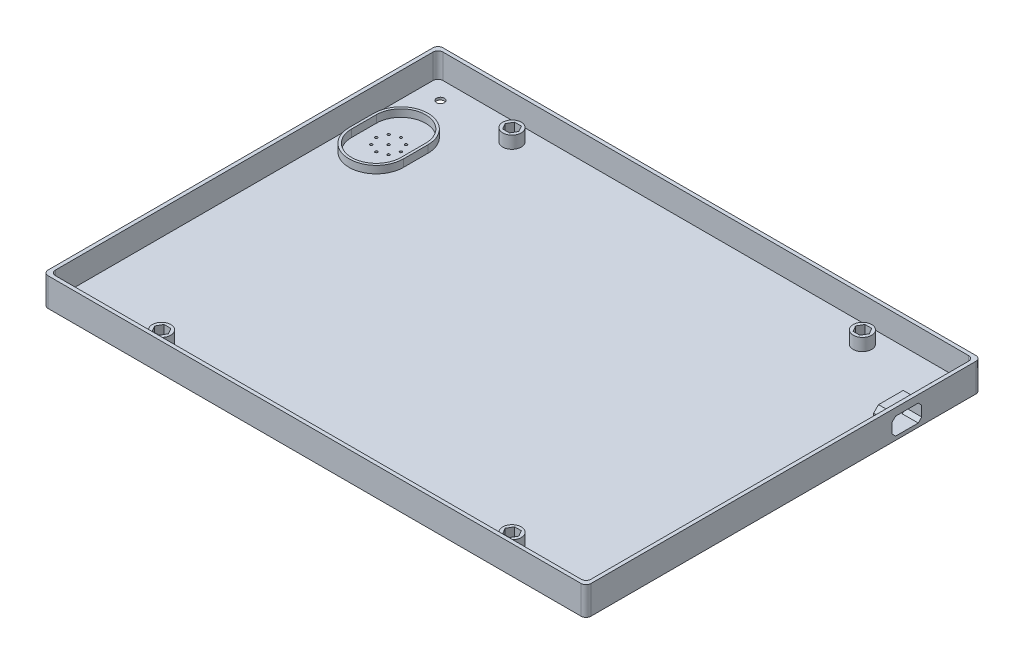
from build123d import *

# Parameters (mm, degrees)
EXTRUDE_1_DEPTH                 = 1
EXTRUDE_1_DEPTH_BACK            = 0.5
SKETCH_1_W                      = 220
SKETCH_1_H                      = 160
SKETCH_2_R                      = 3.75
EXTRUDE_2_DEPTH                 = 5
CUT_EXTRUDE_5_REACH             = 138.17
SKETCH_3_R                      = 1.6
CUT_EXTRUDE_5_DIRECTION_2_DEPTH = 137.169930601
CUT_EXTRUDE_START               = -0.5
SKETCH_4_R                      = 3
CUT_EXTRUDE_7_DEPTH             = 0.5
SKETCH_5_W                      = 220
SKETCH_5_H                      = 160
SKETCH_5_W_2                    = 217
SKETCH_5_H_2                    = 157
EXTRUDE_3_DEPTH                 = 10
FILLET_1_R                      = 2
FILLET_2_R                      = 2
FILLET_3_R                      = 2
CUT_EXTRUDE_8_REACH             = 236.352
CUT_EXTRUDE_8_DIRECTION_2_DEPTH = 235.352298901
EXTRUDE_4_DEPTH                 = 5
EXTRUDE_5_DEPTH                 = 3
CUT_EXTRUDE_9_REACH             = 138.382
SKETCH_10_R                     = 0.5


with BuildPart() as part:
    # 草图1 → 凸台-拉伸1 (new, two sides: drawn at the far end of the back side and taken through both)
    with BuildSketch(Plane(origin=(0, 0, 0), x_dir=(1, 0, 0), z_dir=(0, 1, 0)).offset(-EXTRUDE_1_DEPTH_BACK)):
        Rectangle(SKETCH_1_W, SKETCH_1_H)
    extrude(amount=EXTRUDE_1_DEPTH + EXTRUDE_1_DEPTH_BACK)

    # 草图2 → 凸台-拉伸2 (add)
    # profile 1 of 4: a face of its own
    with BuildSketch(Plane(origin=(0, 1, 0), x_dir=(1, 0, 0), z_dir=(0, 1, 0))):
        with Locations(Location((-71, 71, 0), (0, 0, 270))):
            Circle(SKETCH_2_R)
        Polygon((-69.614359354, 68.6), (-68.228718708, 71), (-69.614359354, 73.4), (-72.385640646, 73.4), (-73.771281292, 71), (-72.385640646, 68.6), align=None, mode=Mode.SUBTRACT)
    # profile 2 of 4: a face of its own
    with BuildSketch(Plane(origin=(0, 1, 0), x_dir=(1, 0, 0), z_dir=(0, 1, 0))):
        with Locations(Location((71, 71, 0), (0, 0, 90))):
            Circle(SKETCH_2_R)
        Polygon((72.385640646, 68.6), (69.614359354, 68.6), (68.228718708, 71), (69.614359354, 73.4), (72.385640646, 73.4), (73.771281292, 71), align=None, mode=Mode.SUBTRACT)
    # profile 3 of 4: a face of its own
    with BuildSketch(Plane(origin=(0, 1, 0), x_dir=(1, 0, 0), z_dir=(0, 1, 0))):
        with Locations(Location((71, -71, 0), (0, 0, 270))):
            Circle(SKETCH_2_R)
        Polygon((69.614359354, -68.6), (68.228718708, -71), (69.614359354, -73.4), (72.385640646, -73.4), (73.771281292, -71), (72.385640646, -68.6), align=None, mode=Mode.SUBTRACT)
    # profile 4 of 4: a face of its own
    with BuildSketch(Plane(origin=(0, 1, 0), x_dir=(1, 0, 0), z_dir=(0, 1, 0))):
        with Locations(Location((-71, -71, 0), (0, 0, 90))):
            Circle(SKETCH_2_R)
        Polygon((-72.385640646, -68.6), (-69.614359354, -68.6), (-68.228718708, -71), (-69.614359354, -73.4), (-72.385640646, -73.4), (-73.771281292, -71), align=None, mode=Mode.SUBTRACT)
    extrude(amount=EXTRUDE_2_DEPTH)

    # 草图3 → 切除-拉伸5 (cut, up to next)
    with BuildSketch(Plane.XZ.offset(0.5), mode=Mode.PRIVATE) as cut_extrude_5_sk1:
        with Locations(Location((-100, -71, 0), (0, 0, 90))):
            Circle(SKETCH_3_R)
    cut_extrude_5_tool1 = extrude(cut_extrude_5_sk1.sketch, amount=-CUT_EXTRUDE_5_REACH, mode=Mode.PRIVATE) & part.part
    # 草图3 → 切除-拉伸5 (cut, up to next)
    with BuildSketch(Plane.XZ.offset(0.5), mode=Mode.PRIVATE) as cut_extrude_5_sk2:
        with Locations(Location((100, -71, 0), (0, 0, 90))):
            Circle(SKETCH_3_R)
    cut_extrude_5_tool2 = extrude(cut_extrude_5_sk2.sketch, amount=-CUT_EXTRUDE_5_REACH, mode=Mode.PRIVATE) & part.part
    # 草图3 → 切除-拉伸5 (cut, up to next)
    with BuildSketch(Plane.XZ.offset(0.5), mode=Mode.PRIVATE) as cut_extrude_5_sk3:
        with Locations(Location((100, 71, 0), (0, 0, 90))):
            Circle(SKETCH_3_R)
    cut_extrude_5_tool3 = extrude(cut_extrude_5_sk3.sketch, amount=-CUT_EXTRUDE_5_REACH, mode=Mode.PRIVATE) & part.part
    # 草图3 → 切除-拉伸5 (cut, up to next)
    with BuildSketch(Plane.XZ.offset(0.5), mode=Mode.PRIVATE) as cut_extrude_5_sk4:
        with Locations(Location((-100, 71, 0), (0, 0, 90))):
            Circle(SKETCH_3_R)
    cut_extrude_5_tool4 = extrude(cut_extrude_5_sk4.sketch, amount=-CUT_EXTRUDE_5_REACH, mode=Mode.PRIVATE) & part.part
    add(cut_extrude_5_tool1.solids().sort_by_distance((-100, -0.5, -71))[0], mode=Mode.SUBTRACT)
    add(cut_extrude_5_tool2.solids().sort_by_distance((100, -0.5, -71))[0], mode=Mode.SUBTRACT)
    add(cut_extrude_5_tool3.solids().sort_by_distance((100, -0.5, 71))[0], mode=Mode.SUBTRACT)
    add(cut_extrude_5_tool4.solids().sort_by_distance((-100, -0.5, 71))[0], mode=Mode.SUBTRACT)

    # 草图3 → 切除-拉伸5 direction 2 (cut)
    with BuildSketch(Plane.XZ.offset(0.5)):
        with Locations(Location((-100, -71, 0), (0, 0, 90))):
            Circle(SKETCH_3_R)
        with Locations(Location((100, -71, 0), (0, 0, 90))):
            Circle(SKETCH_3_R)
        with Locations(Location((100, 71, 0), (0, 0, 90))):
            Circle(SKETCH_3_R)
        with Locations(Location((-100, 71, 0), (0, 0, 90))):
            Circle(SKETCH_3_R)
    extrude(amount=CUT_EXTRUDE_5_DIRECTION_2_DEPTH, mode=Mode.SUBTRACT)

    # 草图4 → 切除-拉伸7 (cut)
    with BuildSketch(Plane(origin=(0, 0, 0), x_dir=(1, 0, 0), z_dir=(0, 1, 0)).offset(CUT_EXTRUDE_START)):
        with Locations(Location((-100, 71, 0), (0, 0, 270))):
            Circle(SKETCH_4_R)
        with Locations(Location((100, 71, 0), (0, 0, 90))):
            Circle(SKETCH_4_R)
        with Locations(Location((100, -71, 0), (0, 0, 270))):
            Circle(SKETCH_4_R)
        with Locations(Location((-100, -71, 0), (0, 0, 90))):
            Circle(SKETCH_4_R)
    extrude(amount=CUT_EXTRUDE_7_DEPTH, mode=Mode.SUBTRACT)

    # 草图5 → 凸台-拉伸3 (add)
    with BuildSketch(Plane(origin=(0, 1, 0), x_dir=(1, 0, 0), z_dir=(0, 1, 0))):
        Rectangle(SKETCH_5_W, SKETCH_5_H)
        Rectangle(SKETCH_5_W_2, SKETCH_5_H_2, mode=Mode.SUBTRACT)
    extrude(amount=EXTRUDE_3_DEPTH)

    # 圆角1
    fillet_1_edges = [part.edges().sort_by_distance(p)[0] for p in [
        (-110, 5.25, -80),
    ]]
    fillet(fillet_1_edges, radius=FILLET_1_R)

    # 圆角2
    fillet_2_edges = [part.edges().sort_by_distance(p)[0] for p in [
        (-108.5, 6, -78.5),
    ]]
    fillet(fillet_2_edges, radius=FILLET_2_R)

    # 圆角3
    fillet_3_edges = [part.edges().sort_by_distance(p)[0] for p in [
        (108.5, 6, 78.5),
        (108.5, 6, -78.5),
        (-108.5, 6, 78.5),
        (110, 5.25, 80),
        (-110, 5.25, 80),
        (110, 5.25, -80),
    ]]
    fillet(fillet_3_edges, radius=FILLET_3_R)

    # 草图7 → 切除-拉伸8 (cut, up to next)
    with BuildSketch(Plane(origin=(110, 0, 0), x_dir=(0, 0, -1), z_dir=(1, 0, 0)), mode=Mode.PRIVATE) as cut_extrude_8_sk1:
        Polygon((45.435952693, 8), (54.607525568, 8), (56.02173913, 6.585786438), (56.02173913, 2.414213562), (54.607525568, 1), (45.435952693, 1), (44.02173913, 2.414213562), (44.02173913, 6.585786438), align=None)
    cut_extrude_8_tool1 = extrude(cut_extrude_8_sk1.sketch, amount=-CUT_EXTRUDE_8_REACH, mode=Mode.PRIVATE) & part.part
    add(cut_extrude_8_tool1.solids().sort_by_distance((110, 4.5, -50.021739))[0], mode=Mode.SUBTRACT)

    # 草图7 → 切除-拉伸8 direction 2 (cut)
    with BuildSketch(Plane(origin=(110, 0, 0), x_dir=(0, 0, -1), z_dir=(1, 0, 0))):
        Polygon((45.435952693, 8), (54.607525568, 8), (56.02173913, 6.585786438), (56.02173913, 2.414213562), (54.607525568, 1), (45.435952693, 1), (44.02173913, 2.414213562), (44.02173913, 6.585786438), align=None)
    extrude(amount=CUT_EXTRUDE_8_DIRECTION_2_DEPTH, mode=Mode.SUBTRACT)

    # 草图8 → 凸台-拉伸4 (add)
    with BuildSketch(Plane.ZY.offset(-108.5)):
        Polygon((-44.435952693, 1), (-43.02173913, 2.414213562), (-43.02173913, 7), (-45.02173913, 9), (-55.02173913, 9), (-57.02173913, 7), (-57.02173913, 2.414213562), (-55.607525568, 1), (-54.607525568, 1), (-56.02173913, 2.414213562), (-56.02173913, 6.585786438), (-54.607525568, 8), (-45.435952693, 8), (-44.02173913, 6.585786438), (-44.02173913, 2.414213562), (-45.435952693, 1), align=None)
    extrude(amount=EXTRUDE_4_DEPTH)

    # 草图9 → 凸台-拉伸5 (add)
    with BuildSketch(Plane(origin=(0, 1, 0), x_dir=(1, 0, 0), z_dir=(0, 1, 0))):
        with BuildLine():
            Line((-84, 50), (-84, 40))
            ThreePointArc((-84, 40), (-95, 29), (-106, 40))
            Line((-106, 40), (-106, 50))
            ThreePointArc((-106, 50), (-95, 61), (-84, 50))
        make_face()
        with BuildLine():
            Line((-85, 50), (-85, 40))
            ThreePointArc((-85, 40), (-95, 30), (-105, 40))
            Line((-105, 40), (-105, 50))
            ThreePointArc((-105, 50), (-95, 60), (-85, 50))
        make_face(mode=Mode.SUBTRACT)
    extrude(amount=EXTRUDE_5_DEPTH)

    # 草图10 → 切除-拉伸9 (cut, up to next)
    with BuildSketch(Plane(origin=(0, 1, 0), x_dir=(1, 0, 0), z_dir=(0, 1, 0)), mode=Mode.PRIVATE) as cut_extrude_9_sk1:
        with Locations(Location((-95, 45, 0), (0, 0, 270))):
            Circle(SKETCH_10_R)
    cut_extrude_9_tool1 = extrude(cut_extrude_9_sk1.sketch, amount=-CUT_EXTRUDE_9_REACH, mode=Mode.PRIVATE) & part.part
    # 草图10 → 切除-拉伸9 (cut, up to next)
    with BuildSketch(Plane(origin=(0, 1, 0), x_dir=(1, 0, 0), z_dir=(0, 1, 0)), mode=Mode.PRIVATE) as cut_extrude_9_sk2:
        with Locations(Location((-100, 45, 0), (0, 0, 270))):
            Circle(SKETCH_10_R)
    cut_extrude_9_tool2 = extrude(cut_extrude_9_sk2.sketch, amount=-CUT_EXTRUDE_9_REACH, mode=Mode.PRIVATE) & part.part
    # 草图10 → 切除-拉伸9 (cut, up to next)
    with BuildSketch(Plane(origin=(0, 1, 0), x_dir=(1, 0, 0), z_dir=(0, 1, 0)), mode=Mode.PRIVATE) as cut_extrude_9_sk3:
        with Locations(Location((-98.535533906, 48.535533906, 0), (0, 0, 270))):
            Circle(SKETCH_10_R)
    cut_extrude_9_tool3 = extrude(cut_extrude_9_sk3.sketch, amount=-CUT_EXTRUDE_9_REACH, mode=Mode.PRIVATE) & part.part
    # 草图10 → 切除-拉伸9 (cut, up to next)
    with BuildSketch(Plane(origin=(0, 1, 0), x_dir=(1, 0, 0), z_dir=(0, 1, 0)), mode=Mode.PRIVATE) as cut_extrude_9_sk4:
        with Locations(Location((-95, 50, 0), (0, 0, 270))):
            Circle(SKETCH_10_R)
    cut_extrude_9_tool4 = extrude(cut_extrude_9_sk4.sketch, amount=-CUT_EXTRUDE_9_REACH, mode=Mode.PRIVATE) & part.part
    # 草图10 → 切除-拉伸9 (cut, up to next)
    with BuildSketch(Plane(origin=(0, 1, 0), x_dir=(1, 0, 0), z_dir=(0, 1, 0)), mode=Mode.PRIVATE) as cut_extrude_9_sk5:
        with Locations(Location((-91.464466094, 48.535533906, 0), (0, 0, 270))):
            Circle(SKETCH_10_R)
    cut_extrude_9_tool5 = extrude(cut_extrude_9_sk5.sketch, amount=-CUT_EXTRUDE_9_REACH, mode=Mode.PRIVATE) & part.part
    # 草图10 → 切除-拉伸9 (cut, up to next)
    with BuildSketch(Plane(origin=(0, 1, 0), x_dir=(1, 0, 0), z_dir=(0, 1, 0)), mode=Mode.PRIVATE) as cut_extrude_9_sk6:
        with Locations(Location((-90, 45, 0), (0, 0, 270))):
            Circle(SKETCH_10_R)
    cut_extrude_9_tool6 = extrude(cut_extrude_9_sk6.sketch, amount=-CUT_EXTRUDE_9_REACH, mode=Mode.PRIVATE) & part.part
    # 草图10 → 切除-拉伸9 (cut, up to next)
    with BuildSketch(Plane(origin=(0, 1, 0), x_dir=(1, 0, 0), z_dir=(0, 1, 0)), mode=Mode.PRIVATE) as cut_extrude_9_sk7:
        with Locations(Location((-91.464466094, 41.464466094, 0), (0, 0, 270))):
            Circle(SKETCH_10_R)
    cut_extrude_9_tool7 = extrude(cut_extrude_9_sk7.sketch, amount=-CUT_EXTRUDE_9_REACH, mode=Mode.PRIVATE) & part.part
    # 草图10 → 切除-拉伸9 (cut, up to next)
    with BuildSketch(Plane(origin=(0, 1, 0), x_dir=(1, 0, 0), z_dir=(0, 1, 0)), mode=Mode.PRIVATE) as cut_extrude_9_sk8:
        with Locations(Location((-95, 40, 0), (0, 0, 270))):
            Circle(SKETCH_10_R)
    cut_extrude_9_tool8 = extrude(cut_extrude_9_sk8.sketch, amount=-CUT_EXTRUDE_9_REACH, mode=Mode.PRIVATE) & part.part
    # 草图10 → 切除-拉伸9 (cut, up to next)
    with BuildSketch(Plane(origin=(0, 1, 0), x_dir=(1, 0, 0), z_dir=(0, 1, 0)), mode=Mode.PRIVATE) as cut_extrude_9_sk9:
        with Locations(Location((-98.535533906, 41.464466094, 0), (0, 0, 270))):
            Circle(SKETCH_10_R)
    cut_extrude_9_tool9 = extrude(cut_extrude_9_sk9.sketch, amount=-CUT_EXTRUDE_9_REACH, mode=Mode.PRIVATE) & part.part
    add(cut_extrude_9_tool1.solids().sort_by_distance((-95, 1, -45))[0], mode=Mode.SUBTRACT)
    add(cut_extrude_9_tool2.solids().sort_by_distance((-100, 1, -45))[0], mode=Mode.SUBTRACT)
    add(cut_extrude_9_tool3.solids().sort_by_distance((-98.535534, 1, -48.535534))[0], mode=Mode.SUBTRACT)
    add(cut_extrude_9_tool4.solids().sort_by_distance((-95, 1, -50))[0], mode=Mode.SUBTRACT)
    add(cut_extrude_9_tool5.solids().sort_by_distance((-91.464466, 1, -48.535534))[0], mode=Mode.SUBTRACT)
    add(cut_extrude_9_tool6.solids().sort_by_distance((-90, 1, -45))[0], mode=Mode.SUBTRACT)
    add(cut_extrude_9_tool7.solids().sort_by_distance((-91.464466, 1, -41.464466))[0], mode=Mode.SUBTRACT)
    add(cut_extrude_9_tool8.solids().sort_by_distance((-95, 1, -40))[0], mode=Mode.SUBTRACT)
    add(cut_extrude_9_tool9.solids().sort_by_distance((-98.535534, 1, -41.464466))[0], mode=Mode.SUBTRACT)


solid = part.part
